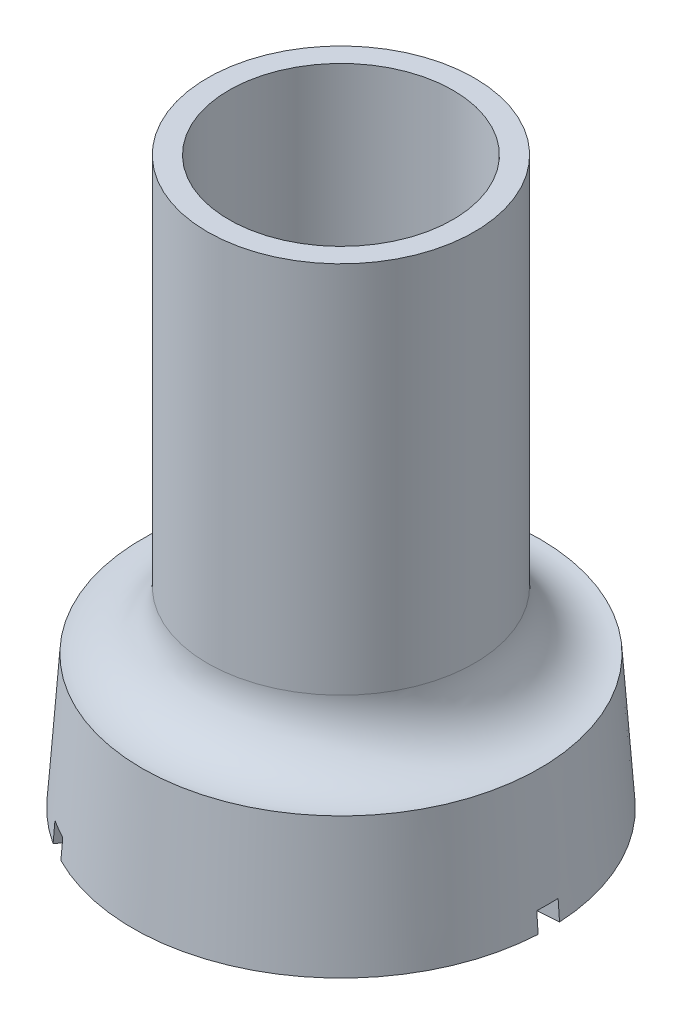
from build123d import *

# Parameters (mm, degrees)
SZKIC8_W                    = 0.2
SZKIC8_H                    = 0.4
WYTNIJ_WYCI_GNI_CIE11_DEPTH = 0.26
SZYK_KO_OWY1_COUNT          = 3


with BuildPart() as part:
    # Szkic2 → Obrót-cienka ścianka3 (revolve)
    with BuildSketch(Plane(origin=(0, 0, 0), x_dir=(0, 0, -1), z_dir=(1, 0, 0))):
        with BuildLine():
            Line((1.25, 5.3), (1.25, 1.8))
            ThreePointArc((1.25, 1.8), (1.433795811, 1.38964102), (1.862343608, 1.25354481))
            Line((1.862343608, 1.25354481), (1.95, 0))
            Line((1.95, 0), (1.75048719, -0.013951295))
            Line((1.75048719, -0.013951295), (1.675359173, 1.060429406))
            ThreePointArc((1.675359173, 1.060429406), (1.227295617, 1.315737995), (1.05, 1.8))
            Line((1.05, 1.8), (1.05, 5.3))
            Line((1.05, 5.3), (1.25, 5.3))
        make_face()
    revolve(axis=Axis((0, 0, 0), (0, 1, 0)))

    # Szkic8 → Wytnij-wyciągnięcie11 (cut)
    with BuildSketch(Plane(origin=(1.95, 0, 0), x_dir=(0, 0, -1), z_dir=(1, 0, 0))):
        with Locations((0, -0.013951295)):
            Rectangle(SZKIC8_W, SZKIC8_H)
    wytnij_wyci_gni_cie11 = extrude(amount=-WYTNIJ_WYCI_GNI_CIE11_DEPTH, mode=Mode.SUBTRACT)

    # Szyk kołowy1: Wytnij-wyciągnięcie11 ×3 about axis
    szyk_ko_owy1_axis = Axis((0, 0, 0), (0, 1, 0))
    for i in range(1, SZYK_KO_OWY1_COUNT):
        add(wytnij_wyci_gni_cie11.rotate(szyk_ko_owy1_axis, i * 360 / SZYK_KO_OWY1_COUNT), mode=Mode.SUBTRACT)


solid = part.part
